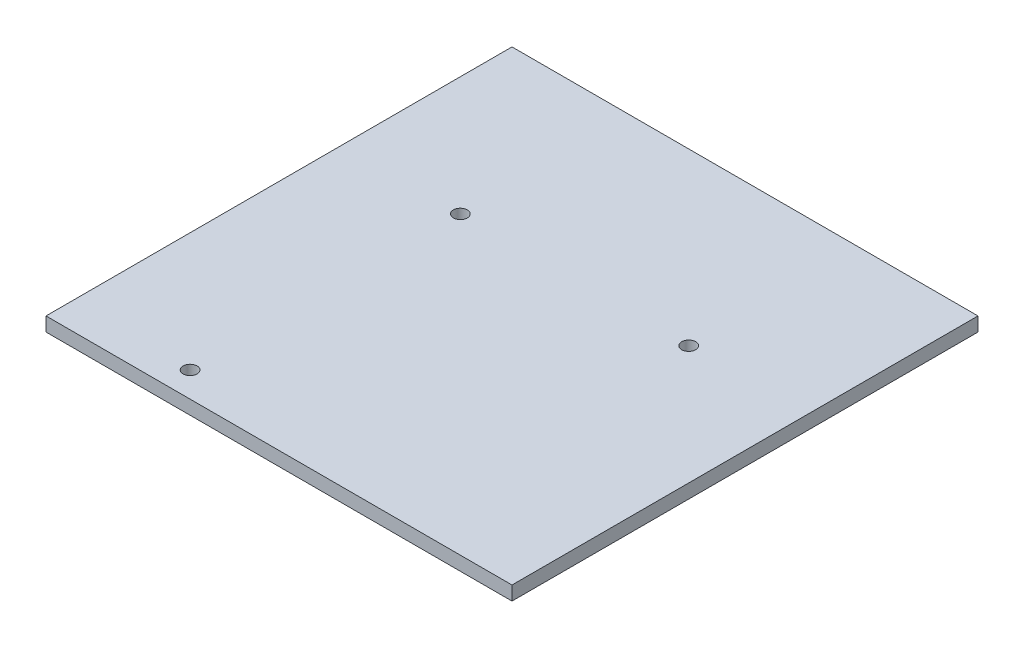
from build123d import *

# Parameters (mm, degrees)
CROQUIS1_W              = 100
CROQUIS1_H              = 100
CROQUIS1_R              = 1.5
SALIENTE_EXTRUIR1_DEPTH = 3


with BuildPart() as part:
    # Croquis1 → Saliente-Extruir1 (new body)
    with BuildSketch(Plane(origin=(0, 0, 0), x_dir=(1, 0, 0), z_dir=(0, 1, 0))):
        Rectangle(CROQUIS1_W, CROQUIS1_H)
        with Locations(Location((-24.5, 13.422802508, 0), (0, 0, 270))):
            Circle(CROQUIS1_R, mode=Mode.SUBTRACT)
        with Locations(Location((24.5, 13.422802508, 0), (0, 0, 270))):
            Circle(CROQUIS1_R, mode=Mode.SUBTRACT)
        with Locations(Location((-24.5, -44.577197492, 0), (0, 0, 270))):
            Circle(CROQUIS1_R, mode=Mode.SUBTRACT)
    extrude(amount=SALIENTE_EXTRUIR1_DEPTH)


solid = part.part
